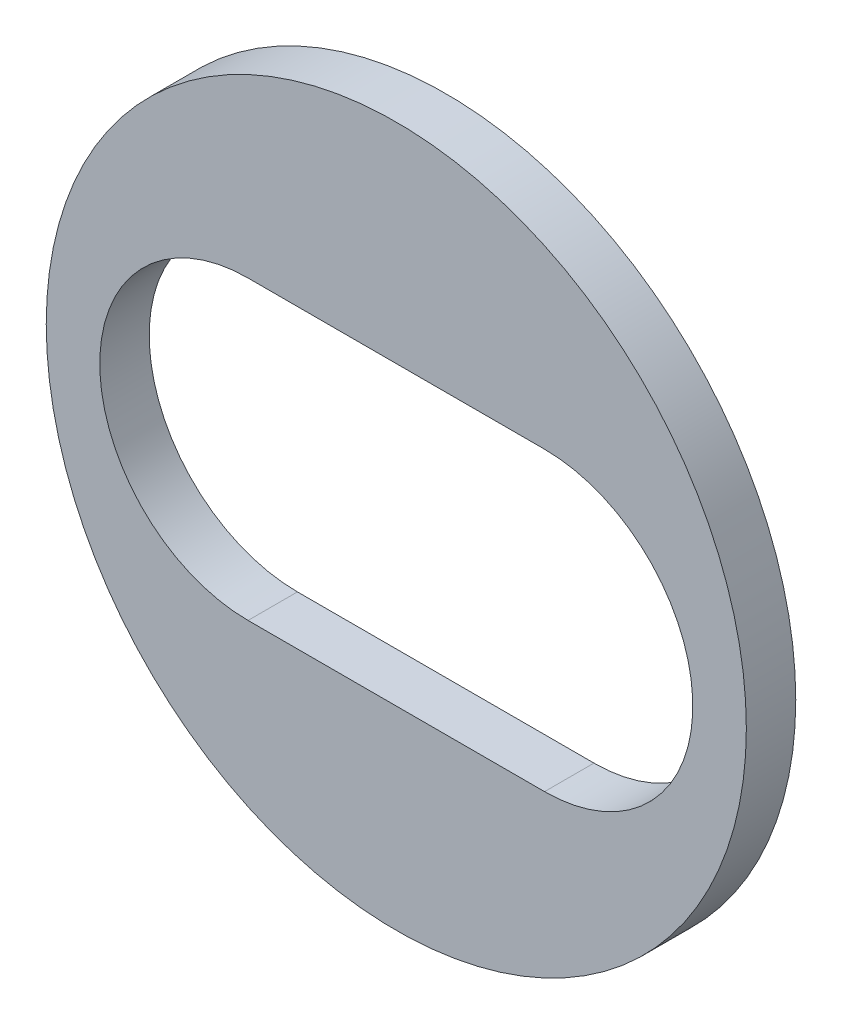
from build123d import *

# Parameters (mm, degrees)
ESQUISSE1_R                  = 42.5
BOSS_EXTRU_1_DEPTH           = 6
ENL_V_MAT_EXTRU_6_DEPTH      = 61.402814504
ENL_V_MAT_EXTRU_6_DEPTH_BACK = 6


with BuildPart() as part:
    # Esquisse1 → Boss.-Extru.1 (new body)
    with BuildSketch(Plane.XY):
        Circle(ESQUISSE1_R)
    extrude(amount=BOSS_EXTRU_1_DEPTH)

    # Esquisse3 → Enlèv. mat.-Extru.6 (cut, two sides: drawn at the far end of the back side and taken through both)
    with BuildSketch(Plane.XY.offset(-ENL_V_MAT_EXTRU_6_DEPTH_BACK)):
        with BuildLine():
            Line((-18, -18.9), (18, -18.9))
            ThreePointArc((18, -18.9), (36, -0.9), (18, 17.1))
            Line((18, 17.1), (-18, 17.1))
            ThreePointArc((-18, 17.1), (-36, -0.9), (-18, -18.9))
        make_face()
    extrude(amount=ENL_V_MAT_EXTRU_6_DEPTH + ENL_V_MAT_EXTRU_6_DEPTH_BACK, mode=Mode.SUBTRACT)


solid = part.part
